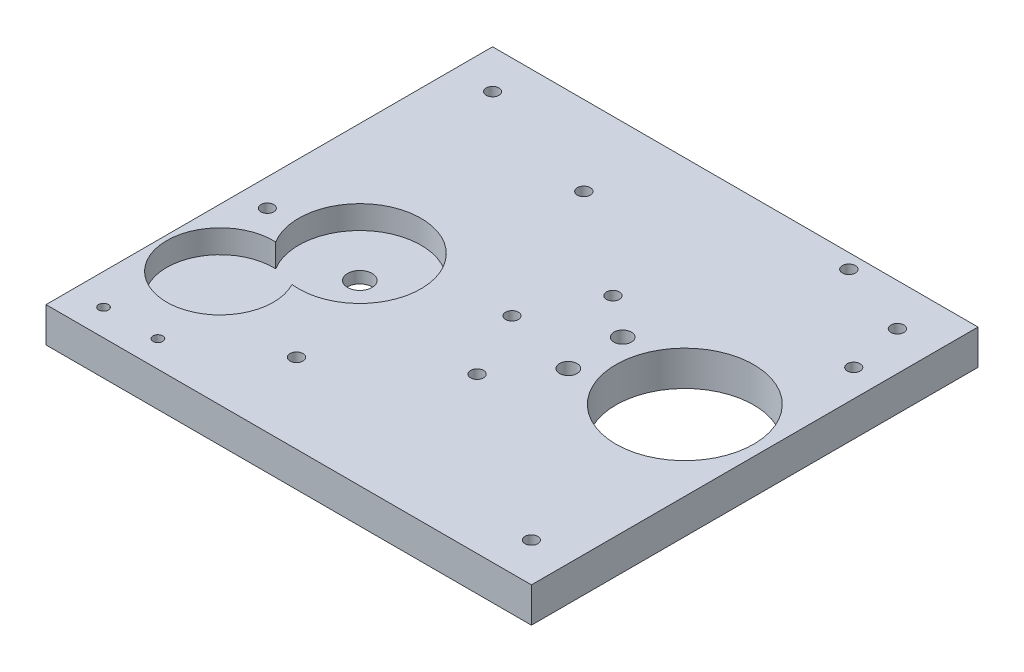
from build123d import *

# Parameters (mm, degrees)
SKETCH1_W                 = 125
SKETCH1_H                 = 115
TOP_BASE_DEPTH            = 9
SKETCH5_R                 = 15.75
SKETCH5_R_2               = 13.75
GEARS_EXTRUDE_CUT_DEPTH   = 6
SKETCH7_R                 = 3.15
KEY_EXTRUDE_CUT_DEPTH     = 171.091152033
SKETCH8_R                 = 17.75
THUMB_EXTRUDE_CUT_DEPTH   = 171.091152033
SKETCH9_R                 = 1.675
SKETCH9_R_2               = 2.25
MOUNT_HOLES_DEPTH         = 5
M3X0_5_TAPPED_HOLE1_D     = 2.5
M3X0_5_TAPPED_HOLE1_DEPTH = 7.5
M3X0_5_TAPPED_HOLE1_TIP   = 0.751075774
M4X0_7_TAPPED_HOLE1_D     = 3.3
M4X0_7_TAPPED_HOLE1_DEPTH = 10.1
M4X0_7_TAPPED_HOLE1_TIP   = 0.991420021


with BuildPart() as part:
    # Sketch1 → Top_Base (new body)
    with BuildSketch(Plane(origin=(0, 0, 0), x_dir=(1, 0, 0), z_dir=(0, 1, 0))):
        with Locations((62.5, 57.5)):
            Rectangle(SKETCH1_W, SKETCH1_H)
    extrude(amount=TOP_BASE_DEPTH)

    # Sketch5 → Gears_Extrude_Cut (cut)
    with BuildSketch(Plane(origin=(0, 9, 0), x_dir=(1, 0, 0), z_dir=(0, 1, 0))):
        with Locations((29.01540546, 51.79347369)):
            Circle(SKETCH5_R)
        with Locations((15, 29.820255536)):
            Circle(SKETCH5_R_2)
    extrude(amount=-GEARS_EXTRUDE_CUT_DEPTH, mode=Mode.SUBTRACT)

    # Sketch7 → Key_Extrude_Cut (cut, through all)
    with BuildSketch(Plane(origin=(0, 9, 0), x_dir=(1, 0, 0), z_dir=(0, 1, 0))):
        with Locations(Location((29.01540546, 51.79347369, 0), (0, 0, 270))):
            Circle(SKETCH7_R)
    extrude(amount=-KEY_EXTRUDE_CUT_DEPTH, mode=Mode.SUBTRACT)

    # Sketch8 → Thumb_Extrude_Cut (cut, through all)
    with BuildSketch(Plane(origin=(0, 9, 0), x_dir=(1, 0, 0), z_dir=(0, 1, 0))):
        with Locations(Location((104.5, 60, 0), (0, 0, 270))):
            Circle(SKETCH8_R)
    extrude(amount=-THUMB_EXTRUDE_CUT_DEPTH, mode=Mode.SUBTRACT)

    # Sketch9 → Mount_Holes (cut)
    with BuildSketch(Plane(origin=(0, 9, 0), x_dir=(1, 0, 0), z_dir=(0, 1, 0))):
        with Locations(Location((71, 75, 0), (0, 0, 270))):
            Circle(SKETCH9_R)
        with Locations(Location((44, 94.5, 0), (0, 0, 270))):
            Circle(SKETCH9_R)
        with Locations(Location((81.5, 67, 0), (0, 0, 270))):
            Circle(SKETCH9_R_2)
        with Locations(Location((95.5, 111.25, 0), (0, 0, 270))):
            Circle(SKETCH9_R)
        with Locations(Location((115, 104.25, 0), (0, 0, 270))):
            Circle(SKETCH9_R)
        with Locations(Location((71, 40, 0), (0, 0, 90))):
            Circle(SKETCH9_R)
        with Locations(Location((44, 20.5, 0), (0, 0, 90))):
            Circle(SKETCH9_R)
        with Locations(Location((81.5, 53, 0), (0, 0, 90))):
            Circle(SKETCH9_R_2)
    extrude(amount=-MOUNT_HOLES_DEPTH, mode=Mode.SUBTRACT)

    # M3x0.5 Tapped Hole1
    with Locations(Plane(origin=(8, 9, -6.820255536), x_dir=(0, 0, 1), z_dir=(0, 1, 0))):
        with Locations((0, 0), (0, 14)):
            Hole(M3X0_5_TAPPED_HOLE1_D / 2, depth=M3X0_5_TAPPED_HOLE1_DEPTH)
            with Locations((0, 0, -(M3X0_5_TAPPED_HOLE1_DEPTH + M3X0_5_TAPPED_HOLE1_TIP / 2))):  # 118° drill point
                Cone(0, M3X0_5_TAPPED_HOLE1_D / 2, M3X0_5_TAPPED_HOLE1_TIP, mode=Mode.SUBTRACT)

    # M4x0.7 Tapped Hole1
    with Locations(Plane(origin=(10, 9, -105), x_dir=(0, 0, 1), z_dir=(0, 1, 0))):
        with Locations((0, 0), (15, 108), (95, 105), (55, -3), (47.5, 52.5)):
            Hole(M4X0_7_TAPPED_HOLE1_D / 2, depth=M4X0_7_TAPPED_HOLE1_DEPTH)
            with Locations((0, 0, -(M4X0_7_TAPPED_HOLE1_DEPTH + M4X0_7_TAPPED_HOLE1_TIP / 2))):  # 118° drill point
                Cone(0, M4X0_7_TAPPED_HOLE1_D / 2, M4X0_7_TAPPED_HOLE1_TIP, mode=Mode.SUBTRACT)


solid = part.part
